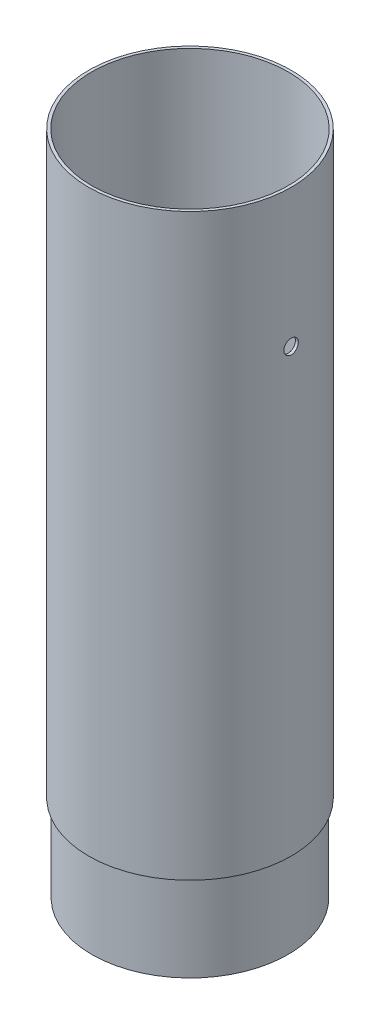
from build123d import *

# Parameters (mm, degrees)
SKETCH1_R           = 35
SKETCH1_R_2         = 34
BOSS_EXTRUDE1_DEPTH = 200
SKETCH2_R           = 34
SKETCH2_R_2         = 32.9
BOSS_EXTRUDE2_DEPTH = 2
BOSS_EXTRUDE3_START = 30
SKETCH3_R           = 33.9
SKETCH3_R_2         = 32.9
BOSS_EXTRUDE3_DEPTH = 30
SKETCH4_R           = 2.5
CUT_EXTRUDE1_DEPTH  = 40


with BuildPart() as part:
    # Sketch1 → Boss-Extrude1 (new body)
    with BuildSketch(Plane(origin=(0, 0, 0), x_dir=(1, 0, 0), z_dir=(0, 1, 0))):
        with Locations(Location((0, 0, 0), (0, 0, 270))):
            Circle(SKETCH1_R)
        with Locations(Location((0, 0, 0), (0, 0, 270))):
            Circle(SKETCH1_R_2, mode=Mode.SUBTRACT)
    extrude(amount=BOSS_EXTRUDE1_DEPTH)

    # Sketch2 → Boss-Extrude2 (add)
    with BuildSketch(Plane.XZ):
        with Locations(Location((0, 0, 0), (0, 0, 270))):
            Circle(SKETCH2_R)
        with Locations(Location((0, 0, 0), (0, 0, 270))):
            Circle(SKETCH2_R_2, mode=Mode.SUBTRACT)
    extrude(amount=-BOSS_EXTRUDE2_DEPTH)

    # Sketch3 → Boss-Extrude3 (add)
    with BuildSketch(Plane.XZ.offset(BOSS_EXTRUDE3_START)):
        with Locations(Location((0, 0, 0), (0, 0, 90))):
            Circle(SKETCH3_R)
        with Locations(Location((0, 0, 0), (0, 0, 270))):
            Circle(SKETCH3_R_2, mode=Mode.SUBTRACT)
    extrude(amount=-BOSS_EXTRUDE3_DEPTH)

    # Sketch4 → Cut-Extrude1 (cut)
    with BuildSketch(Plane(origin=(0, 0, 0), x_dir=(0, 0, -1), z_dir=(1, 0, 0))):
        with Locations(Location((0, 152.404493748, 0), (0, 0, 180))):
            Circle(SKETCH4_R)
    extrude(amount=CUT_EXTRUDE1_DEPTH, mode=Mode.SUBTRACT)


solid = part.part
